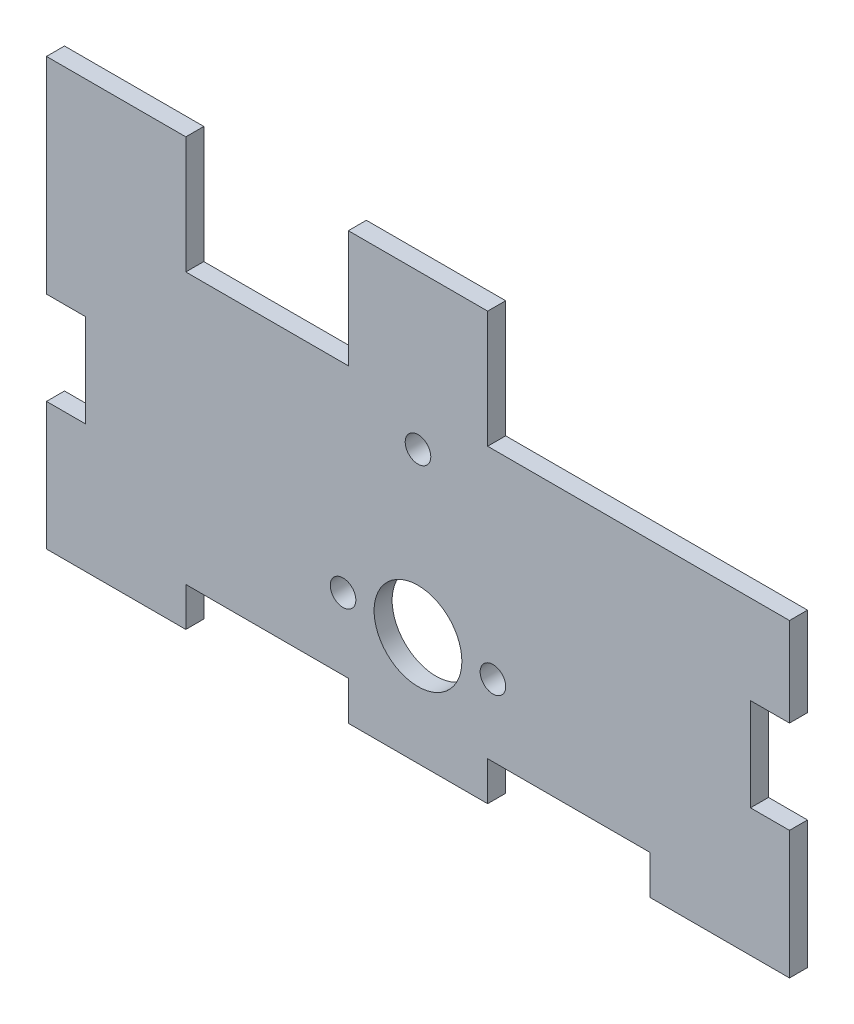
from build123d import *

# Parameters (mm, degrees)
SKETCH1_W           = 101.6
SKETCH1_H           = 36.999999914
BOSS_EXTRUDE1_DEPTH = 2.4638
SKETCH2_R           = 5.999999938
SKETCH2_R_2         = 1.750000056
MOTORHOLES_DEPTH    = 55.119869816
SKETCH3_W           = 19.05
SKETCH3_H           = 2.4638
BOTTOMTEETH_DEPTH   = 5.334
SKETCH4_W           = 10.668
SKETCH4_H           = 12.7
CUT_EXTRUDE2_DEPTH  = 57.167338057
SKETCH5_W           = 19.05
SKETCH5_H           = 2.4638
TOPTEETH_DEPTH      = 16.002


with BuildPart() as part:
    # Sketch1 → Boss-Extrude1 (new body)
    with BuildSketch(Plane.XY):
        Rectangle(SKETCH1_W, SKETCH1_H)
    extrude(amount=BOSS_EXTRUDE1_DEPTH)

    # Sketch2 → MotorHoles (cut, through all)
    with BuildSketch(Plane.XY.offset(2.4638)):
        with Locations((0, -8.730000066)):
            Circle(SKETCH2_R)
        with Locations((-10.250000074, -8.730000066)):
            Circle(SKETCH2_R_2)
        with Locations((0, 13.36999993)):
            Circle(SKETCH2_R_2)
        with Locations(Location((10.250000074, -8.730000066, 0), (0, 0, 180))):
            Circle(SKETCH2_R_2)
    extrude(amount=-MOTORHOLES_DEPTH, mode=Mode.SUBTRACT)

    # Sketch3 → BottomTeeth (add)
    with BuildSketch(Plane.XZ.offset(18.499999957)):
        with Locations((-41.275, 1.2319)):
            Rectangle(SKETCH3_W, SKETCH3_H)
        with Locations((41.275, 1.2319)):
            Rectangle(SKETCH3_W, SKETCH3_H)
        with Locations((0, 1.2319)):
            Rectangle(SKETCH3_W, SKETCH3_H)
    extrude(amount=BOTTOMTEETH_DEPTH)

    # Sketch4 → Cut-Extrude2 (cut, through all)
    with BuildSketch(Plane.XY.offset(2.4638)):
        with Locations((-50.8, 0)):
            Rectangle(SKETCH4_W, SKETCH4_H)
        with Locations((50.8, 0)):
            Rectangle(SKETCH4_W, SKETCH4_H)
    extrude(amount=-CUT_EXTRUDE2_DEPTH, mode=Mode.SUBTRACT)

    # Sketch5 → TopTeeth (add)
    with BuildSketch(Plane(origin=(0, 18.499999957, 0), x_dir=(1, 0, 0), z_dir=(0, 1, 0))):
        with Locations((-41.275, -1.2319)):
            Rectangle(SKETCH5_W, SKETCH5_H)
        with Locations((0, -1.2319)):
            Rectangle(SKETCH5_W, SKETCH5_H)
    extrude(amount=TOPTEETH_DEPTH)


solid = part.part
